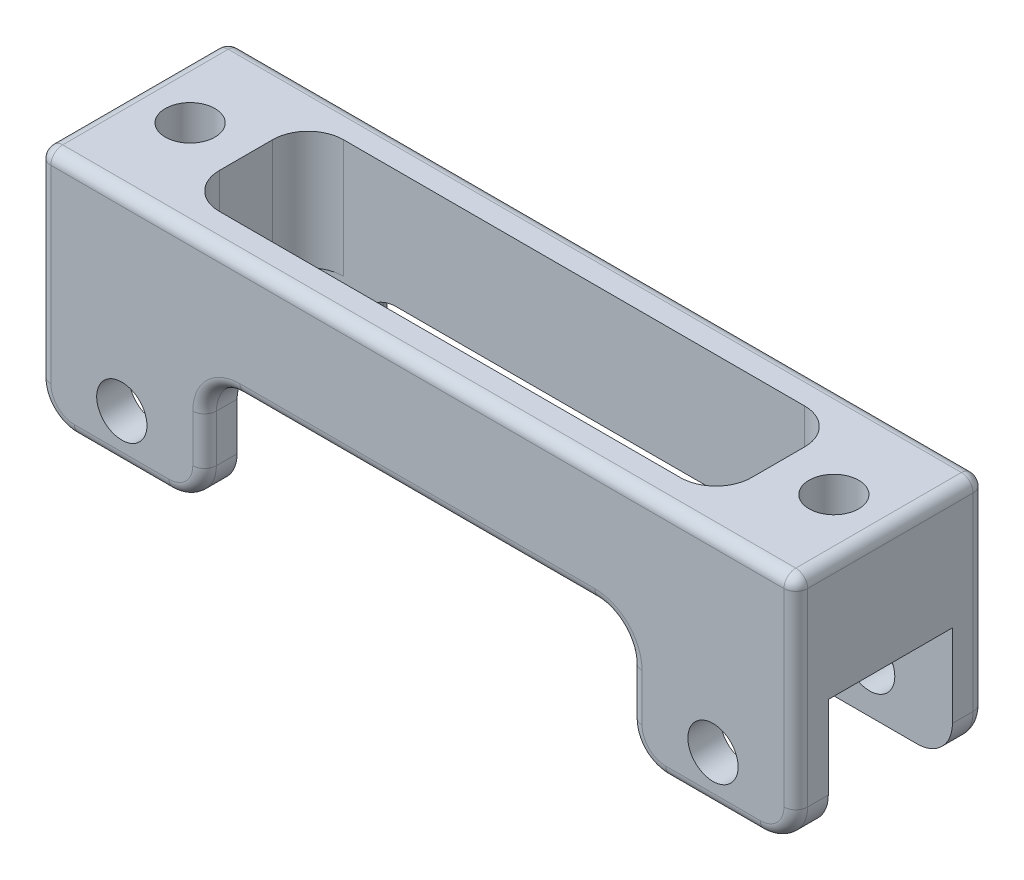
from build123d import *

# Parameters (mm, degrees)
SKETCH_1_W             = 64
SKETCH_1_H             = 16
EXTRUDE_1_DEPTH        = 20
SKETCH_3_R             = 2.125
CUT_EXTRUDE_1_DEPTH    = 28
SKETCH_4_W             = 36
SKETCH_4_H             = 10
CUT_EXTRUDE_2_DEPTH    = 20
SKETCH_5_W             = 64
SKETCH_5_H             = 10.5
CUT_EXTRUDE_3_DEPTH    = 10
HOLE_WIZARD_M5_1_D     = 4.2
HOLE_WIZARD_M5_1_DEPTH = 12.4
HOLE_WIZARD_M5_1_TIP   = 1.2618073
FILLET_1_R             = 3
FILLET_2_R             = 3
SKETCH_7_W             = 45
SKETCH_7_H             = 10.5
CUT_EXTRUDE_4_DEPTH    = 10
FILLET_3_R             = 3
FILLET_4_R             = 1


with BuildPart() as part:
    # 草图1 → 凸台-拉伸1 (new body)
    with BuildSketch(Plane(origin=(0, 0, 0), x_dir=(1, 0, 0), z_dir=(0, 1, 0))):
        Rectangle(SKETCH_1_W, SKETCH_1_H)
    extrude(amount=EXTRUDE_1_DEPTH)

    # 草图3 → 切除-拉伸1 (cut)
    with BuildSketch(Plane.XY.offset(8)):
        with Locations((-25, 4)):
            Circle(SKETCH_3_R)
        with Locations((25, 4)):
            Circle(SKETCH_3_R)
    extrude(amount=-CUT_EXTRUDE_1_DEPTH, mode=Mode.SUBTRACT)

    # 草图4 → 切除-拉伸2 (cut)
    with BuildSketch(Plane.XY.offset(8)):
        with Locations((0, 5)):
            Rectangle(SKETCH_4_W, SKETCH_4_H)
    extrude(amount=-CUT_EXTRUDE_2_DEPTH, mode=Mode.SUBTRACT)

    # 草图5 → 切除-拉伸3 (cut)
    with BuildSketch(Plane.XZ):
        Rectangle(SKETCH_5_W, SKETCH_5_H)
    extrude(amount=-CUT_EXTRUDE_3_DEPTH, mode=Mode.SUBTRACT)

    # M5 螺纹孔1
    with Locations(Plane(origin=(27.223611076, 20, 0), x_dir=(0, 0, 1), z_dir=(0, 1, 0))):
        with Locations((0, 0), (0, -54.447222152)):
            Hole(HOLE_WIZARD_M5_1_D / 2, depth=HOLE_WIZARD_M5_1_DEPTH)
            with Locations((0, 0, -(HOLE_WIZARD_M5_1_DEPTH + HOLE_WIZARD_M5_1_TIP / 2))):  # 118° drill point
                Cone(0, HOLE_WIZARD_M5_1_D / 2, HOLE_WIZARD_M5_1_TIP, mode=Mode.SUBTRACT)

    # 圆角1
    fillet_1_edges = [part.edges().sort_by_distance(p)[0] for p in [
        (-18, 0, -6.625),
        (18, 0, 6.625),
        (-18, 0, 6.625),
        (18, 0, -6.625),
        (-32, 0, 6.625),
        (-32, 0, -6.625),
        (32, 0, -6.625),
        (32, 0, 6.625),
    ]]
    fillet(fillet_1_edges, radius=FILLET_1_R)

    # 圆角2
    fillet_2_edges = [part.edges().sort_by_distance(p)[0] for p in [
        (-18, 10, -6.625),
        (18, 10, -6.625),
        (-18, 10, 6.625),
        (18, 10, 6.625),
    ]]
    fillet(fillet_2_edges, radius=FILLET_2_R)

    # 草图7 → 切除-拉伸4 (cut)
    with BuildSketch(Plane(origin=(0, 20, 0), x_dir=(1, 0, 0), z_dir=(0, 1, 0))):
        Rectangle(SKETCH_7_W, SKETCH_7_H)
    extrude(amount=-CUT_EXTRUDE_4_DEPTH, mode=Mode.SUBTRACT)

    # 圆角3
    fillet_3_edges = [part.edges().sort_by_distance(p)[0] for p in [
        (22.5, 15, -5.25),
        (22.5, 15, 5.25),
        (-22.5, 15, 5.25),
        (-22.5, 15, -5.25),
    ]]
    fillet(fillet_3_edges, radius=FILLET_3_R)

    # 圆角4
    fillet_4_edges = [part.edges().sort_by_distance(p)[0] for p in [
        (31.121320344, 0.878679656, -8),
        (25, 0, 8),
        (18, 5, 8),
        (-25, 0, 8),
        (-18.878679656, 0.878679656, 8),
        (-31.121320344, 0.878679656, 8),
        (18.878679656, 0.878679656, 8),
        (31.121320344, 0.878679656, 8),
        (-32, 20, 0),
        (0, 10, -8),
        (0, 10, 8),
        (-18, 5, -8),
        (-18, 5, 8),
        (17.121320344, 9.121320344, -8),
        (17.121320344, 9.121320344, 8),
        (-17.121320344, 9.121320344, -8),
        (-17.121320344, 9.121320344, 8),
        (0, 20, 8),
        (32, 20, 0),
        (32, 11.5, 8),
        (-32, 11.5, 8),
        (-32, 11.5, -8),
        (32, 11.5, -8),
        (0, 20, -8),
        (25, 0, -8),
        (18, 5, -8),
        (-25, 0, -8),
        (-31.121320344, 0.878679656, -8),
        (-18.878679656, 0.878679656, -8),
        (18.878679656, 0.878679656, -8),
    ]]
    fillet(fillet_4_edges, radius=FILLET_4_R)


solid = part.part
